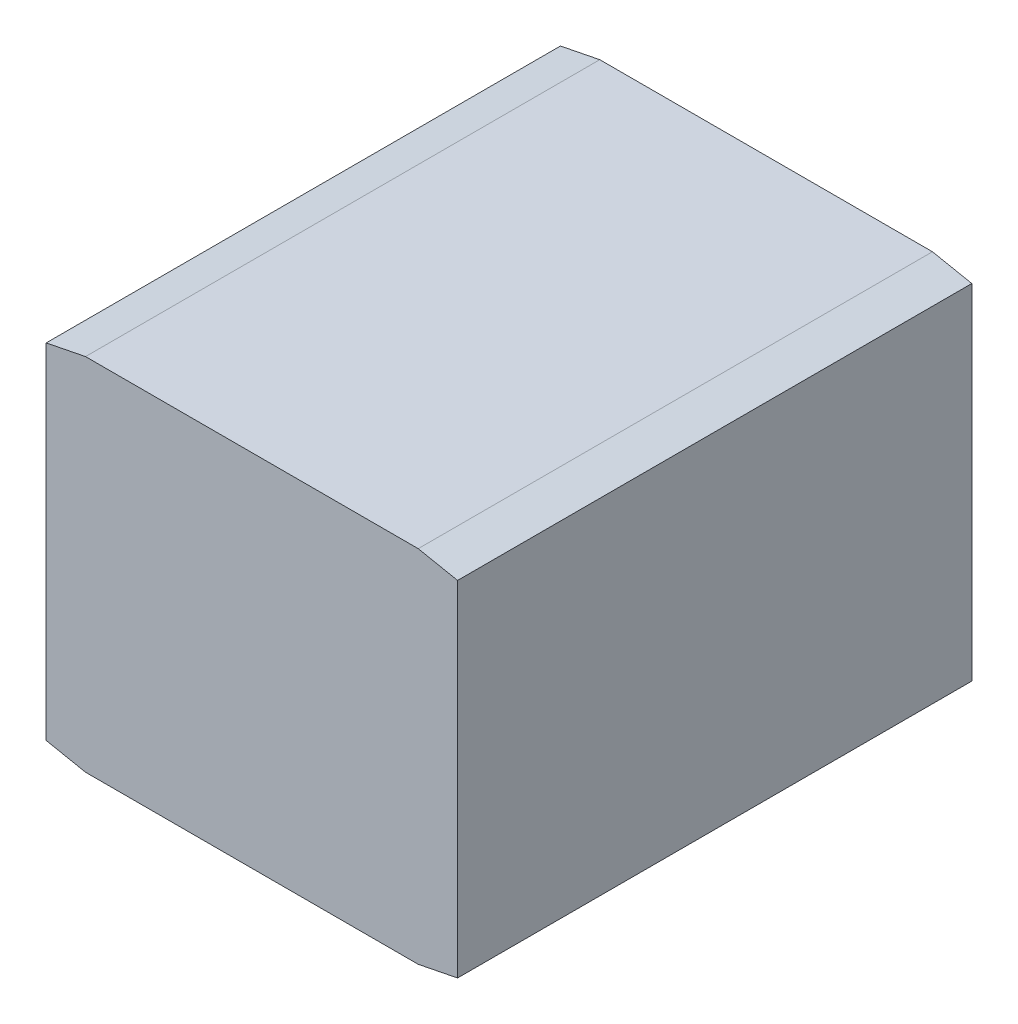
from build123d import *

# Parameters (mm, degrees)
BOSS_EXTRU_1_DEPTH = 10


with BuildPart() as part:
    # Esquisse1 → Boss.-Extru.1 (new body)
    with BuildSketch(Plane.XY):
        Polygon((4, 3.347755687), (3.234616154, 3.5), (-3.234616154, 3.5), (-4, 3.347755687), (-4, -3.347755687), (-3.234616154, -3.5), (3.234616154, -3.5), (4, -3.347755687), align=None)
    extrude(amount=BOSS_EXTRU_1_DEPTH)


solid = part.part
